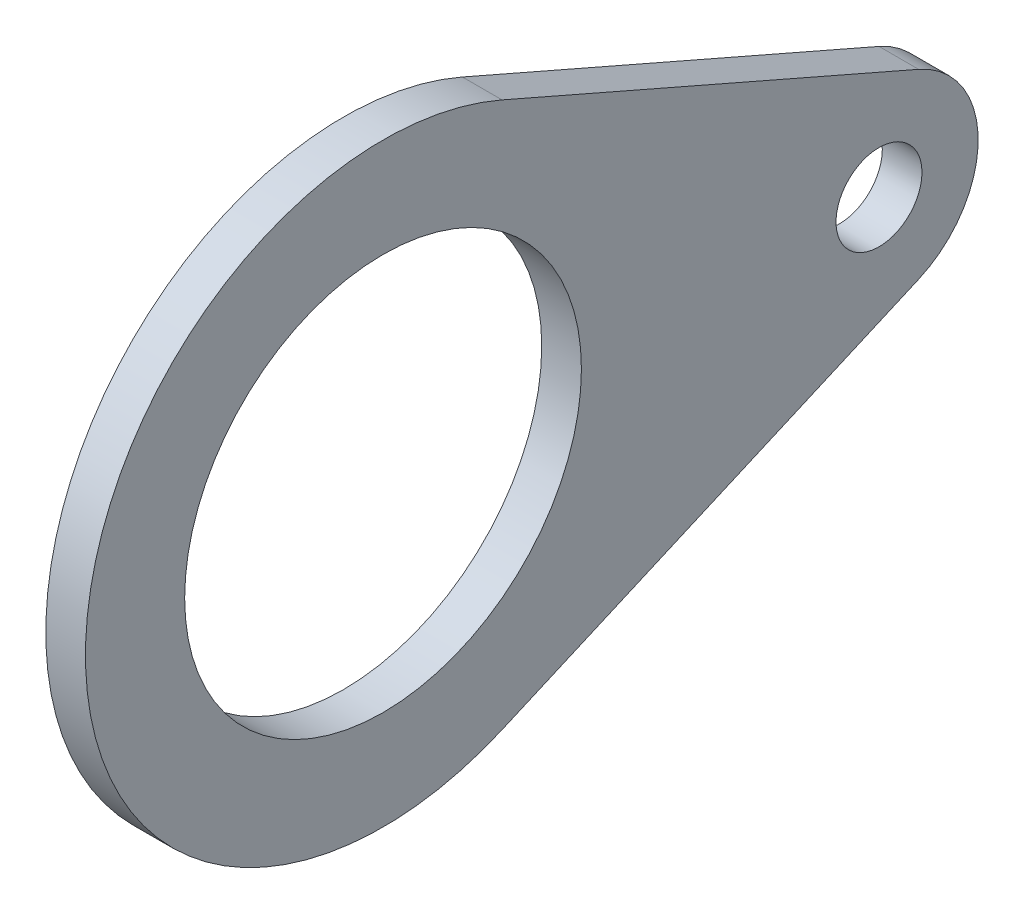
from build123d import *

# Parameters (mm, degrees)
SKETCH_1_R      = 30
SKETCH_1_R_2    = 6.5
EXTRUDE_1_DEPTH = 6


with BuildPart() as part:
    # 草图1 → 凸台-拉伸1 (new body)
    with BuildSketch(Plane(origin=(0, 0, 0), x_dir=(0, 0, -1), z_dir=(1, 0, 0))):
        with BuildLine():
            Line((18, 41.243181255), (81, 13.747727085))
            ThreePointArc((81, 13.747727085), (90, 0), (81, -13.747727085))
            Line((81, -13.747727085), (18, -41.243181255))
            ThreePointArc((18, -41.243181255), (-45, 0), (18, 41.243181255))
        make_face()
        Circle(SKETCH_1_R, mode=Mode.SUBTRACT)
        with Locations((75, 0)):
            Circle(SKETCH_1_R_2, mode=Mode.SUBTRACT)
    extrude(amount=EXTRUDE_1_DEPTH)


solid = part.part
